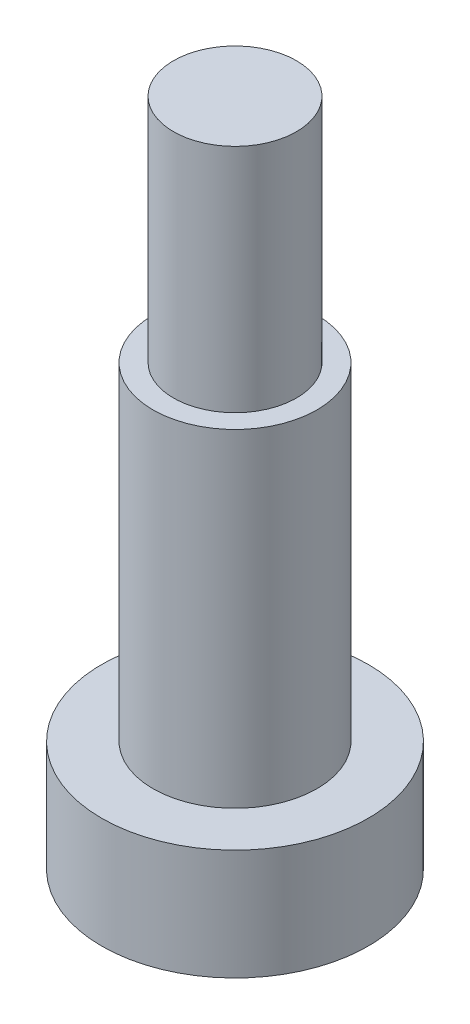
from build123d import *

# Parameters (mm, degrees)
SKETCH_1_R      = 6.5
EXTRUDE_1_DEPTH = 5.4
SKETCH_2_R      = 4
EXTRUDE_2_DEPTH = 16
SKETCH_3_R      = 3
EXTRUDE_3_DEPTH = 11.25


with BuildPart() as part:
    # 草图1 → 凸台-拉伸1 (new body)
    with BuildSketch(Plane(origin=(0, 0, 0), x_dir=(1, 0, 0), z_dir=(0, 1, 0))):
        with Locations(Location((0, 0, 0), (0, 0, 90))):
            Circle(SKETCH_1_R)
    extrude(amount=EXTRUDE_1_DEPTH)

    # 草图2 → 凸台-拉伸2 (add)
    with BuildSketch(Plane(origin=(0, 5.4, 0), x_dir=(1, 0, 0), z_dir=(0, 1, 0))):
        with Locations(Location((0, 0, 0), (0, 0, 270))):
            Circle(SKETCH_2_R)
    extrude(amount=EXTRUDE_2_DEPTH)

    # 草图3 → 凸台-拉伸3 (add)
    with BuildSketch(Plane(origin=(0, 21.4, 0), x_dir=(1, 0, 0), z_dir=(0, 1, 0))):
        with Locations(Location((0, 0, 0), (0, 0, 90))):
            Circle(SKETCH_3_R)
    extrude(amount=EXTRUDE_3_DEPTH)


solid = part.part
